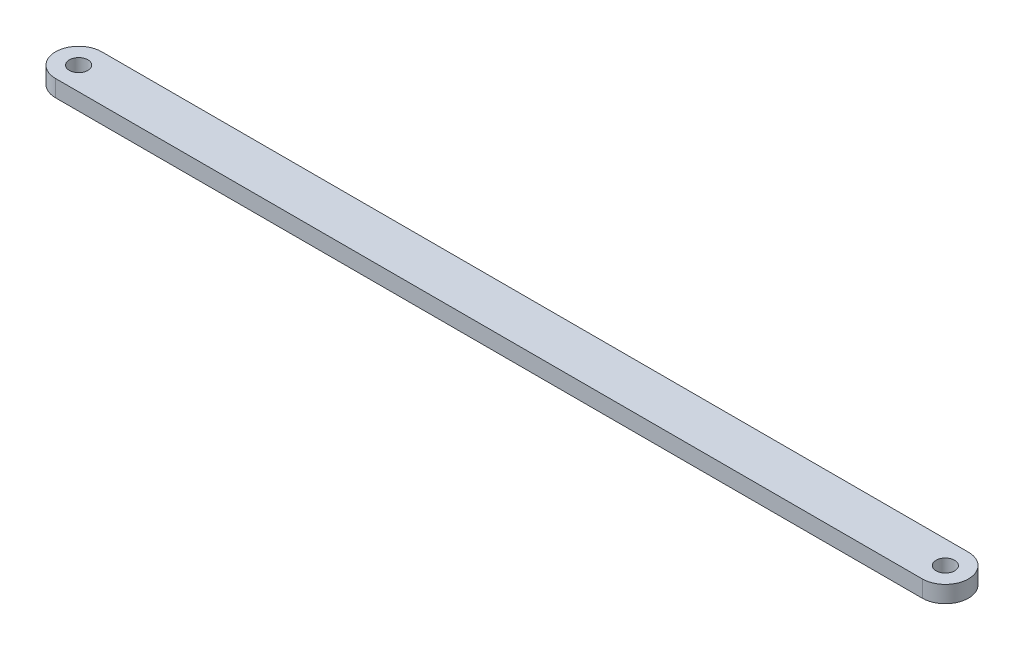
from build123d import *

# Parameters (mm, degrees)
SKETCH1_R           = 1.6
BOSS_EXTRUDE1_DEPTH = 2.9


with BuildPart() as part:
    # Sketch1 → Boss-Extrude1 (new body)
    with BuildSketch(Plane(origin=(0, 0, 0), x_dir=(1, 0, 0), z_dir=(0, 1, 0))):
        with BuildLine():
            Line((0, 4), (150, 4))
            ThreePointArc((150, 4), (154, 0), (150, -4))
            Line((150, -4), (0, -4))
            ThreePointArc((0, -4), (-4, 0), (0, 4))
        make_face()
        with Locations(Location((0, 0, 0), (0, 0, 270))):
            Circle(SKETCH1_R, mode=Mode.SUBTRACT)
        with Locations(Location((150, 0, 0), (0, 0, 270))):
            Circle(SKETCH1_R, mode=Mode.SUBTRACT)
    extrude(amount=BOSS_EXTRUDE1_DEPTH)


solid = part.part
